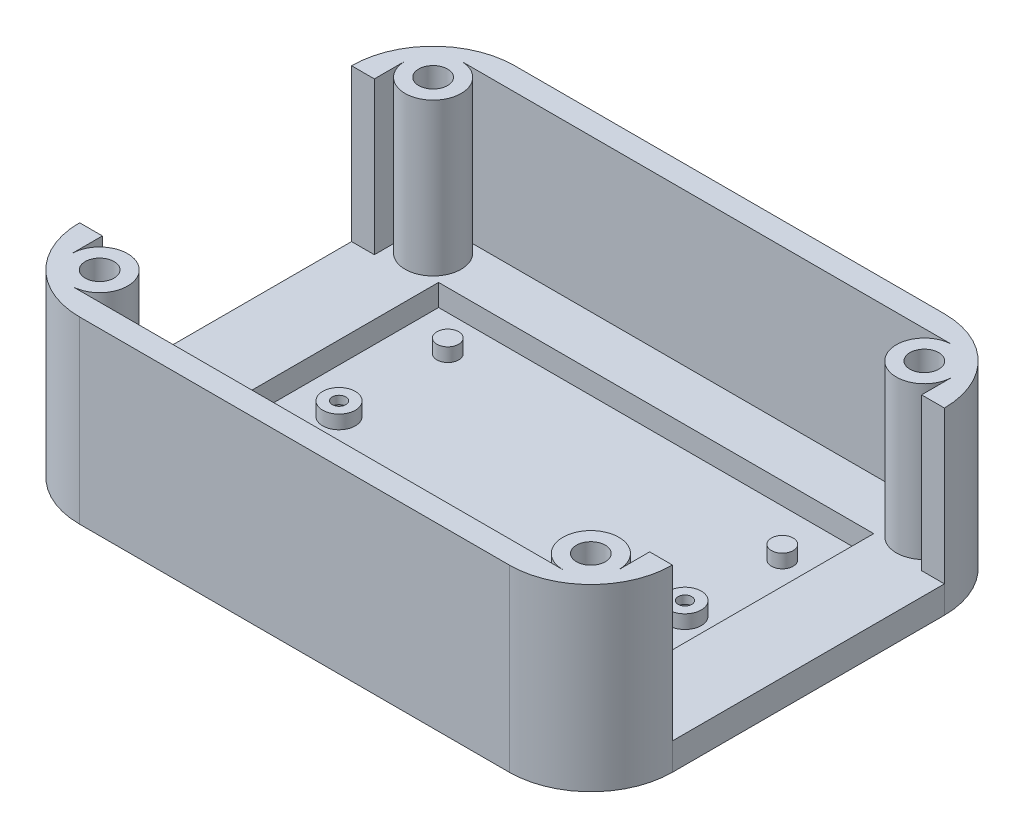
from build123d import *
from build123d.topology import SkipClean

# Parameters (mm, degrees)
BOSS_EXTRUDE1_DEPTH     = 5
BOSS_EXTRUDE3_DEPTH     = 33
CUT_EXTRUDE2_DEPTH      = 121.706255016
CUT_EXTRUDE2_DEPTH_BACK = 121.706255016
SKETCH7_W               = 50
SKETCH7_H               = 28
CUT_EXTRUDE4_START      = 5
SKETCH3_W               = 80
SKETCH3_H               = 53
CUT_EXTRUDE4_DEPTH      = 4
BOSS_EXTRUDE8_START     = -28
SKETCH24_R              = 5.15
SKETCH24_R_2            = 2.65
BOSS_EXTRUDE8_DEPTH     = 28
CUT_EXTRUDE7_START      = -28
CUT_EXTRUDE7_DEPTH      = 28
CUT_EXTRUDE8_START      = -33
SKETCH24_4_R            = 2.65
CUT_EXTRUDE8_DEPTH      = 33
SKETCH25_R              = 3
SKETCH25_R_2            = 2
SKETCH25_R_3            = 1.25
BOSS_EXTRUDE9_DEPTH     = 2.5
SKETCH25_5_R            = 1.25
CUT_EXTRUDE11_DEPTH     = 75.794719065
CUT_EXTRUDE14_START     = -1
SKETCH25_7_R            = 2
SKETCH25_7_R_2          = 1.25
CUT_EXTRUDE14_DEPTH     = 2


with BuildPart() as part:
    # Sketch1 → Boss-Extrude1 (new body)
    with BuildSketch(Plane(origin=(0, 0, 0), x_dir=(1, 0, 0), z_dir=(0, 1, 0))):
        with BuildLine():
            Line((-39.5, 40), (39.5, 40))
            ThreePointArc((39.5, 40), (50.106601718, 35.606601718), (54.5, 25))
            Line((54.5, 25), (54.5, -25))
            ThreePointArc((54.5, -25), (50.106601718, -35.606601718), (39.5, -40))
            Line((39.5, -40), (-39.5, -40))
            ThreePointArc((-39.5, -40), (-50.106601718, -35.606601718), (-54.5, -25))
            Line((-54.5, -25), (-54.5, 25))
            ThreePointArc((-54.5, 25), (-50.106601718, 35.606601718), (-39.5, 40))
        make_face()
    extrude(amount=BOSS_EXTRUDE1_DEPTH)

    # Sketch1<3> → Boss-Extrude3 (add)
    with BuildSketch(Plane(origin=(0, 0, 0), x_dir=(1, 0, 0), z_dir=(0, 1, 0))):
        with BuildLine():
            Line((-39.5, 40), (39.5, 40))
            ThreePointArc((39.5, 40), (50.106601718, 35.606601718), (54.5, 25))
            Line((54.5, 25), (54.5, -25))
            ThreePointArc((54.5, -25), (50.106601718, -35.606601718), (39.5, -40))
            Line((39.5, -40), (-39.5, -40))
            ThreePointArc((-39.5, -40), (-50.106601718, -35.606601718), (-54.5, -25))
            Line((-54.5, -25), (-54.5, 25))
            ThreePointArc((-54.5, 25), (-50.106601718, 35.606601718), (-39.5, 40))
        make_face()
        with BuildLine():
            ThreePointArc((-39.5, 33), (-45.156854249, 30.656854249), (-47.5, 25))
            Line((-47.5, 25), (-47.5, -25))
            ThreePointArc((-47.5, -25), (-45.156854249, -30.656854249), (-39.5, -33))
            Line((-39.5, -33), (39.5, -33))
            ThreePointArc((39.5, -33), (45.156854249, -30.656854249), (47.5, -25))
            Line((47.5, -25), (47.5, 25))
            ThreePointArc((47.5, 25), (45.156854249, 30.656854249), (39.5, 33))
            Line((39.5, 33), (-39.5, 33))
        make_face(mode=Mode.SUBTRACT)
    extrude(amount=BOSS_EXTRUDE3_DEPTH)

    # Sketch7 → Cut-Extrude2 (cut, two sides: drawn at the far end of the back side and taken through both)
    with BuildSketch(Plane.ZY.offset(54.5).offset(-CUT_EXTRUDE2_DEPTH_BACK)):
        with Locations((0, 19)):
            Rectangle(SKETCH7_W, SKETCH7_H)
    extrude(amount=CUT_EXTRUDE2_DEPTH + CUT_EXTRUDE2_DEPTH_BACK, mode=Mode.SUBTRACT)

    # Sketch3 → Cut-Extrude4 (cut)
    with BuildSketch(Plane(origin=(0, 0, 0), x_dir=(1, 0, 0), z_dir=(0, 1, 0)).offset(CUT_EXTRUDE4_START)):
        Rectangle(SKETCH3_W, SKETCH3_H)
    extrude(amount=-CUT_EXTRUDE4_DEPTH, mode=Mode.SUBTRACT)

    # Sketch24 → Boss-Extrude8 (add)
    # profile 1 of 10: a face of its own
    with BuildSketch(Plane(origin=(0, 33, 0), x_dir=(1, 0, 0), z_dir=(0, 1, 0)).offset(BOSS_EXTRUDE8_START)):
        with BuildLine():
            ThreePointArc((-40.536912383, 32.932516165), (-42.436299055, 35.0296199), (-45.156854249, 35.806854249))
            ThreePointArc((-45.156854249, 35.806854249), (-48.798454173, 34.298454173), (-50.306854249, 30.656854249))
            ThreePointArc((-50.306854249, 30.656854249), (-49.5296199, 27.936299055), (-47.432516165, 26.036912383))
            ThreePointArc((-47.432516165, 26.036912383), (-47.162977015, 27.297560286), (-46.694453762, 28.498547566))
            ThreePointArc((-46.694453762, 28.498547566), (-47.03068722, 32.53068722), (-42.998547566, 32.194453762))
            ThreePointArc((-42.998547566, 32.194453762), (-41.797560286, 32.662977015), (-40.536912383, 32.932516165))
        make_face()
    # profile 2 of 10: a face of its own
    with BuildSketch(Plane(origin=(0, 33, 0), x_dir=(1, 0, 0), z_dir=(0, 1, 0)).offset(BOSS_EXTRUDE8_START)):
        with BuildLine():
            ThreePointArc((-40.006854249, 30.656854249), (-40.141118979, 31.825143467), (-40.536912383, 32.932516165))
            ThreePointArc((-40.536912383, 32.932516165), (-41.797560286, 32.662977015), (-42.998547566, 32.194453762))
            ThreePointArc((-42.998547566, 32.194453762), (-42.632768998, 31.464005812), (-42.506854249, 30.656854249))
            ThreePointArc((-42.506854249, 30.656854249), (-43.942798795, 28.301314109), (-46.694453762, 28.498547566))
            ThreePointArc((-46.694453762, 28.498547566), (-47.162977015, 27.297560286), (-47.432516165, 26.036912383))
            ThreePointArc((-47.432516165, 26.036912383), (-46.325143467, 25.641118979), (-45.156854249, 25.506854249))
            ThreePointArc((-45.156854249, 25.506854249), (-41.515254326, 27.015254326), (-40.006854249, 30.656854249))
        make_face()
    # profile 3 of 10: a face of its own
    with BuildSketch(Plane(origin=(0, 33, 0), x_dir=(1, 0, 0), z_dir=(0, 1, 0)).offset(BOSS_EXTRUDE8_START)):
        with BuildLine():
            ThreePointArc((-40.536912383, 32.932516165), (-42.436299055, 35.0296199), (-45.156854249, 35.806854249))
            ThreePointArc((-45.156854249, 35.806854249), (-48.798454173, 34.298454173), (-50.306854249, 30.656854249))
            ThreePointArc((-50.306854249, 30.656854249), (-49.5296199, 27.936299055), (-47.432516165, 26.036912383))
            ThreePointArc((-47.432516165, 26.036912383), (-47.162977015, 27.297560286), (-46.694453762, 28.498547566))
            ThreePointArc((-46.694453762, 28.498547566), (-47.03068722, 32.53068722), (-42.998547566, 32.194453762))
            ThreePointArc((-42.998547566, 32.194453762), (-41.797560286, 32.662977015), (-40.536912383, 32.932516165))
        make_face()
    # profile 4 of 10: a face of its own
    with BuildSketch(Plane(origin=(0, 33, 0), x_dir=(1, 0, 0), z_dir=(0, 1, 0)).offset(BOSS_EXTRUDE8_START)):
        with BuildLine():
            ThreePointArc((-40.006854249, 30.656854249), (-40.141118979, 31.825143467), (-40.536912383, 32.932516165))
            ThreePointArc((-40.536912383, 32.932516165), (-41.797560286, 32.662977015), (-42.998547566, 32.194453762))
            ThreePointArc((-42.998547566, 32.194453762), (-42.632768998, 31.464005812), (-42.506854249, 30.656854249))
            ThreePointArc((-42.506854249, 30.656854249), (-43.942798795, 28.301314109), (-46.694453762, 28.498547566))
            ThreePointArc((-46.694453762, 28.498547566), (-47.162977015, 27.297560286), (-47.432516165, 26.036912383))
            ThreePointArc((-47.432516165, 26.036912383), (-46.325143467, 25.641118979), (-45.156854249, 25.506854249))
            ThreePointArc((-45.156854249, 25.506854249), (-41.515254326, 27.015254326), (-40.006854249, 30.656854249))
        make_face()
    # profile 5 of 10: a face of its own
    with BuildSketch(Plane(origin=(0, 33, 0), x_dir=(1, 0, 0), z_dir=(0, 1, 0)).offset(BOSS_EXTRUDE8_START)):
        with BuildLine():
            ThreePointArc((50.306854249, 30.656854249), (48.798454173, 34.298454173), (45.156854249, 35.806854249))
            ThreePointArc((45.156854249, 35.806854249), (42.436299055, 35.0296199), (40.536912383, 32.932516165))
            ThreePointArc((40.536912383, 32.932516165), (41.797560286, 32.662977015), (42.998547566, 32.194453762))
            ThreePointArc((42.998547566, 32.194453762), (45.964005812, 33.180939501), (47.806854249, 30.656854249))
            ThreePointArc((47.806854249, 30.656854249), (47.51239439, 29.442798795), (46.694453762, 28.498547566))
            ThreePointArc((46.694453762, 28.498547566), (47.162977015, 27.297560286), (47.432516165, 26.036912383))
            ThreePointArc((47.432516165, 26.036912383), (49.5296199, 27.936299055), (50.306854249, 30.656854249))
        make_face()
    # profile 6 of 10: a face of its own
    with BuildSketch(Plane(origin=(0, 33, 0), x_dir=(1, 0, 0), z_dir=(0, 1, 0)).offset(BOSS_EXTRUDE8_START)):
        with BuildLine():
            ThreePointArc((42.998547566, 32.194453762), (41.797560286, 32.662977015), (40.536912383, 32.932516165))
            ThreePointArc((40.536912383, 32.932516165), (40.141118979, 31.825143467), (40.006854249, 30.656854249))
            ThreePointArc((40.006854249, 30.656854249), (41.515254326, 27.015254326), (45.156854249, 25.506854249))
            ThreePointArc((45.156854249, 25.506854249), (46.325143467, 25.641118979), (47.432516165, 26.036912383))
            ThreePointArc((47.432516165, 26.036912383), (47.162977015, 27.297560286), (46.694453762, 28.498547566))
            ThreePointArc((46.694453762, 28.498547566), (43.283021279, 28.783021279), (42.998547566, 32.194453762))
        make_face()
    # profile 7 of 10: a face of its own
    with BuildSketch(Plane(origin=(0, 33, 0), x_dir=(1, 0, 0), z_dir=(0, 1, 0)).offset(BOSS_EXTRUDE8_START)):
        with BuildLine():
            ThreePointArc((50.306854249, 30.656854249), (48.798454173, 34.298454173), (45.156854249, 35.806854249))
            ThreePointArc((45.156854249, 35.806854249), (42.436299055, 35.0296199), (40.536912383, 32.932516165))
            ThreePointArc((40.536912383, 32.932516165), (41.797560286, 32.662977015), (42.998547566, 32.194453762))
            ThreePointArc((42.998547566, 32.194453762), (45.964005812, 33.180939501), (47.806854249, 30.656854249))
            ThreePointArc((47.806854249, 30.656854249), (47.51239439, 29.442798795), (46.694453762, 28.498547566))
            ThreePointArc((46.694453762, 28.498547566), (47.162977015, 27.297560286), (47.432516165, 26.036912383))
            ThreePointArc((47.432516165, 26.036912383), (49.5296199, 27.936299055), (50.306854249, 30.656854249))
        make_face()
    # profile 8 of 10: a face of its own
    with BuildSketch(Plane(origin=(0, 33, 0), x_dir=(1, 0, 0), z_dir=(0, 1, 0)).offset(BOSS_EXTRUDE8_START)):
        with BuildLine():
            ThreePointArc((42.998547566, 32.194453762), (41.797560286, 32.662977015), (40.536912383, 32.932516165))
            ThreePointArc((40.536912383, 32.932516165), (40.141118979, 31.825143467), (40.006854249, 30.656854249))
            ThreePointArc((40.006854249, 30.656854249), (41.515254326, 27.015254326), (45.156854249, 25.506854249))
            ThreePointArc((45.156854249, 25.506854249), (46.325143467, 25.641118979), (47.432516165, 26.036912383))
            ThreePointArc((47.432516165, 26.036912383), (47.162977015, 27.297560286), (46.694453762, 28.498547566))
            ThreePointArc((46.694453762, 28.498547566), (43.283021279, 28.783021279), (42.998547566, 32.194453762))
        make_face()
    # profile 9 of 10: a face of its own
    with BuildSketch(Plane(origin=(0, 33, 0), x_dir=(1, 0, 0), z_dir=(0, 1, 0)).offset(BOSS_EXTRUDE8_START)):
        with Locations((45.156854249, -30.656854249)):
            Circle(SKETCH24_R)
        with Locations((45.156854249, -30.656854249)):
            Circle(SKETCH24_R_2, mode=Mode.SUBTRACT)
    # profile 10 of 10: a face of its own
    with BuildSketch(Plane(origin=(0, 33, 0), x_dir=(1, 0, 0), z_dir=(0, 1, 0)).offset(BOSS_EXTRUDE8_START)):
        with Locations((-45.156854249, -30.656854249)):
            Circle(SKETCH24_R)
        with Locations((-45.156854249, -30.656854249)):
            Circle(SKETCH24_R_2, mode=Mode.SUBTRACT)
    extrude(amount=BOSS_EXTRUDE8_DEPTH)

    # Sketch24<3> → Cut-Extrude7 (cut)
    with SkipClean():  # the faces are left unmerged after this step: merging them gives an invalid solid
        with BuildSketch(Plane(origin=(0, 33, 0), x_dir=(1, 0, 0), z_dir=(0, 1, 0)).offset(CUT_EXTRUDE7_START)):
            with BuildLine():
                Line((45.156854249, 35.806854249), (-45.156854249, 35.806854249))
                ThreePointArc((-45.156854249, 35.806854249), (-42.436299055, 35.0296199), (-40.536912383, 32.932516165))
                ThreePointArc((-40.536912383, 32.932516165), (-40.019553019, 32.983111214), (-39.5, 33))
                Line((-39.5, 33), (39.5, 33))
                ThreePointArc((39.5, 33), (40.019553019, 32.983111214), (40.536912383, 32.932516165))
                ThreePointArc((40.536912383, 32.932516165), (42.436299055, 35.0296199), (45.156854249, 35.806854249))
            make_face()
            with BuildLine():
                ThreePointArc((-47.432516165, 26.036912383), (-49.5296199, 27.936299055), (-50.306854249, 30.656854249))
                Line((-50.306854249, 30.656854249), (-50.306854249, 25))
                Line((-50.306854249, 25), (-47.5, 25))
                ThreePointArc((-47.5, 25), (-47.483111214, 25.519553019), (-47.432516165, 26.036912383))
            make_face()
            with BuildLine():
                Line((50.306854249, 25), (50.306854249, 30.656854249))
                ThreePointArc((50.306854249, 30.656854249), (49.5296199, 27.936299055), (47.432516165, 26.036912383))
                ThreePointArc((47.432516165, 26.036912383), (47.483111214, 25.519553019), (47.5, 25))
                Line((47.5, 25), (50.306854249, 25))
            make_face()
            with BuildLine():
                Line((-47.5, -25), (-50.306854249, -25))
                Line((-50.306854249, -25), (-50.306854249, -30.656854249))
                ThreePointArc((-50.306854249, -30.656854249), (-49.5296199, -27.936299055), (-47.432516165, -26.036912383))
                ThreePointArc((-47.432516165, -26.036912383), (-47.483111214, -25.519553019), (-47.5, -25))
            make_face()
            with BuildLine():
                Line((50.306854249, -30.656854249), (50.306854249, -25))
                Line((50.306854249, -25), (47.5, -25))
                ThreePointArc((47.5, -25), (47.483111214, -25.519553019), (47.432516165, -26.036912383))
                ThreePointArc((47.432516165, -26.036912383), (49.5296199, -27.936299055), (50.306854249, -30.656854249))
            make_face()
            with BuildLine():
                ThreePointArc((-40.536912383, -32.932516165), (-42.436299055, -35.0296199), (-45.156854249, -35.806854249))
                Line((-45.156854249, -35.806854249), (45.156854249, -35.806854249))
                ThreePointArc((45.156854249, -35.806854249), (42.436299055, -35.0296199), (40.536912383, -32.932516165))
                ThreePointArc((40.536912383, -32.932516165), (40.019553019, -32.983111214), (39.5, -33))
                Line((39.5, -33), (-39.5, -33))
                ThreePointArc((-39.5, -33), (-40.019553019, -32.983111214), (-40.536912383, -32.932516165))
            make_face()
            with BuildLine():
                ThreePointArc((-46.694453762, 28.498547566), (-45.156854249, 30.656854249), (-42.998547566, 32.194453762))
                ThreePointArc((-42.998547566, 32.194453762), (-47.03068722, 32.53068722), (-46.694453762, 28.498547566))
            make_face()
            with BuildLine():
                ThreePointArc((46.694453762, 28.498547566), (47.03068722, 32.53068722), (42.998547566, 32.194453762))
                ThreePointArc((42.998547566, 32.194453762), (45.156854249, 30.656854249), (46.694453762, 28.498547566))
            make_face()
            with BuildLine():
                ThreePointArc((42.998547566, -32.194453762), (47.03068722, -32.53068722), (46.694453762, -28.498547566))
                ThreePointArc((46.694453762, -28.498547566), (45.156854249, -30.656854249), (42.998547566, -32.194453762))
            make_face()
            with BuildLine():
                ThreePointArc((-42.998547566, -32.194453762), (-45.156854249, -30.656854249), (-46.694453762, -28.498547566))
                ThreePointArc((-46.694453762, -28.498547566), (-47.03068722, -32.53068722), (-42.998547566, -32.194453762))
            make_face()
        extrude(amount=CUT_EXTRUDE7_DEPTH, mode=Mode.SUBTRACT)

    # Sketch24<4> → Cut-Extrude8 (cut)
    with SkipClean():  # the faces are left unmerged after this step: merging them gives an invalid solid
        with BuildSketch(Plane(origin=(0, 33, 0), x_dir=(1, 0, 0), z_dir=(0, 1, 0)).offset(CUT_EXTRUDE8_START)):
            with Locations(Location((45.156854249, -30.656854249, 0), (0, 0, 270))):
                Circle(SKETCH24_4_R)
            with BuildLine():
                ThreePointArc((46.694453762, 28.498547566), (45.156854249, 30.656854249), (42.998547566, 32.194453762))
                ThreePointArc((42.998547566, 32.194453762), (43.283021279, 28.783021279), (46.694453762, 28.498547566))
            make_face()
            with BuildLine():
                ThreePointArc((47.806854249, 30.656854249), (45.964005812, 33.180939501), (42.998547566, 32.194453762))
                ThreePointArc((42.998547566, 32.194453762), (45.156854249, 30.656854249), (46.694453762, 28.498547566))
                ThreePointArc((46.694453762, 28.498547566), (47.51239439, 29.442798795), (47.806854249, 30.656854249))
            make_face()
            with BuildLine():
                ThreePointArc((-46.694453762, 28.498547566), (-45.156854249, 30.656854249), (-42.998547566, 32.194453762))
                ThreePointArc((-42.998547566, 32.194453762), (-47.03068722, 32.53068722), (-46.694453762, 28.498547566))
            make_face()
            with BuildLine():
                ThreePointArc((-42.506854249, 30.656854249), (-42.632768998, 31.464005812), (-42.998547566, 32.194453762))
                ThreePointArc((-42.998547566, 32.194453762), (-45.156854249, 30.656854249), (-46.694453762, 28.498547566))
                ThreePointArc((-46.694453762, 28.498547566), (-43.942798795, 28.301314109), (-42.506854249, 30.656854249))
            make_face()
            with Locations(Location((-45.156854249, -30.656854249, 0), (0, 0, 270))):
                Circle(SKETCH24_4_R)
        extrude(amount=CUT_EXTRUDE8_DEPTH, mode=Mode.SUBTRACT)

    # Sketch25 → Boss-Extrude9 (add)
    # profile 1 of 8: a face of its own
    with SkipClean():  # the faces are left unmerged after this step: merging them gives an invalid solid
        with BuildSketch(Plane(origin=(0, 1, 0), x_dir=(1, 0, 0), z_dir=(0, 1, 0))):
            with Locations(Location((-31.8, 0, 0), (0, 0, 90))):
                Circle(SKETCH25_R)
            with Locations((-31.8, 0)):
                Circle(SKETCH25_R_2, mode=Mode.SUBTRACT)
        # profile 2 of 8: a face of its own
        with BuildSketch(Plane(origin=(0, 1, 0), x_dir=(1, 0, 0), z_dir=(0, 1, 0))):
            with Locations(Location((31.8, 0, 0), (0, 0, 90))):
                Circle(SKETCH25_R)
            with Locations((31.8, 0)):
                Circle(SKETCH25_R_2, mode=Mode.SUBTRACT)
        # profile 3 of 8: a face of its own
        with BuildSketch(Plane(origin=(0, 1, 0), x_dir=(1, 0, 0), z_dir=(0, 1, 0))):
            with Locations((-31.8, 0)):
                Circle(SKETCH25_R_2)
            with Locations(Location((-31.8, 0, 0), (0, 0, 270))):
                Circle(SKETCH25_R_3, mode=Mode.SUBTRACT)
        # profile 4 of 8: a face of its own
        with BuildSketch(Plane(origin=(0, 1, 0), x_dir=(1, 0, 0), z_dir=(0, 1, 0))):
            with Locations((31.8, 0)):
                Circle(SKETCH25_R_2)
            with Locations(Location((31.8, 0, 0), (0, 0, 270))):
                Circle(SKETCH25_R_3, mode=Mode.SUBTRACT)
        # profile 5 of 8: a face of its own
        with BuildSketch(Plane(origin=(0, 1, 0), x_dir=(1, 0, 0), z_dir=(0, 1, 0))):
            with Locations(Location((-31.8, 20, 0), (0, 0, 90))):
                Circle(SKETCH25_R_2)
        # profile 6 of 8: a face of its own
        with BuildSketch(Plane(origin=(0, 1, 0), x_dir=(1, 0, 0), z_dir=(0, 1, 0))):
            with Locations(Location((31.8, 17.899377537, 0), (0, 0, 90))):
                Circle(SKETCH25_R_2)
        # profile 7 of 8: a face of its own
        with BuildSketch(Plane(origin=(0, 1, 0), x_dir=(1, 0, 0), z_dir=(0, 1, 0))):
            with Locations(Location((31.8, -17.899377537, 0), (0, 0, 90))):
                Circle(SKETCH25_R_2)
        # profile 8 of 8: a face of its own
        with BuildSketch(Plane(origin=(0, 1, 0), x_dir=(1, 0, 0), z_dir=(0, 1, 0))):
            with Locations(Location((-31.8, -20, 0), (0, 0, 90))):
                Circle(SKETCH25_R_2)
        extrude(amount=BOSS_EXTRUDE9_DEPTH)

    # Sketch25<5> → Cut-Extrude11 (cut, through all)
    with SkipClean():  # the faces are left unmerged after this step: merging them gives an invalid solid
        with BuildSketch(Plane(origin=(0, 1, 0), x_dir=(1, 0, 0), z_dir=(0, 1, 0))):
            with Locations(Location((-31.8, 0, 0), (0, 0, 270))):
                Circle(SKETCH25_5_R)
            with Locations(Location((31.8, 0, 0), (0, 0, 270))):
                Circle(SKETCH25_5_R)
        extrude(amount=-CUT_EXTRUDE11_DEPTH, mode=Mode.SUBTRACT)

    # Sketch25<7> → Cut-Extrude14 (cut)
    # profile 1 of 2: a face of its own
    with SkipClean():  # the faces are left unmerged after this step: merging them gives an invalid solid
        with BuildSketch(Plane(origin=(0, 1, 0), x_dir=(1, 0, 0), z_dir=(0, 1, 0)).offset(CUT_EXTRUDE14_START)):
            with Locations(Location((-31.8, 0, 0), (0, 0, 270))):
                Circle(SKETCH25_7_R)
            with Locations(Location((-31.8, 0, 0), (0, 0, 270))):
                Circle(SKETCH25_7_R_2, mode=Mode.SUBTRACT)
        # profile 2 of 2: a face of its own
        with BuildSketch(Plane(origin=(0, 1, 0), x_dir=(1, 0, 0), z_dir=(0, 1, 0)).offset(CUT_EXTRUDE14_START)):
            with Locations(Location((31.8, 0, 0), (0, 0, 270))):
                Circle(SKETCH25_7_R)
            with Locations(Location((31.8, 0, 0), (0, 0, 270))):
                Circle(SKETCH25_7_R_2, mode=Mode.SUBTRACT)
        extrude(amount=CUT_EXTRUDE14_DEPTH, mode=Mode.SUBTRACT)


solid = part.part
